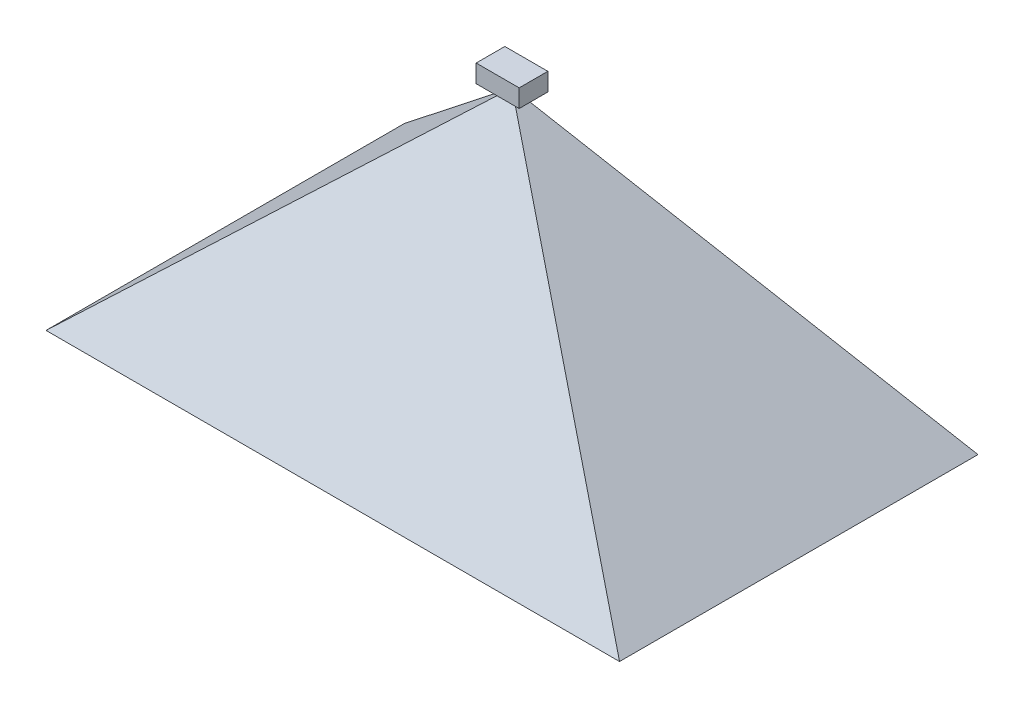
from build123d import *

# Parameters (mm, degrees)
SKETCH3_R         = 2.54
CAMERA_LENS_DEPTH = 2.54
SKETCH4_W         = 15.24
SKETCH4_H         = 10.16
CAMERA_BODY_DEPTH = 6.35


with BuildPart() as part:
    # Sketch2 → FOV section 0
    with BuildSketch(Plane(origin=(0, 90.932, 0), x_dir=(1, 0, 0), z_dir=(0, 1, 0))):
        with BuildLine():
            Line((-2.755394972, -1.722121857), (2.755394972, -1.722121857))
            Line((2.755394972, -1.722121857), (2.755394972, 1.722121857))
            Line((2.755394972, 1.722121857), (-2.755394972, 1.722121857))
            Line((-2.755394972, 1.722121857), (-2.755394972, -1.722121857))
        make_face()
    # Sketch1 → FOV section 1
    with BuildSketch(Plane(origin=(0, 0, 0), x_dir=(1, 0, 0), z_dir=(0, 1, 0))):
        with BuildLine():
            Line((-101.6, -63.5), (101.6, -63.5))
            Line((101.6, -63.5), (101.6, 63.5))
            Line((101.6, 63.5), (-101.6, 63.5))
            Line((-101.6, 63.5), (-101.6, -63.5))
        make_face()
    loft()

    # Sketch3 → camera lens (add)
    with BuildSketch(Plane(origin=(0, 90.932, 0), x_dir=(1, 0, 0), z_dir=(0, 1, 0))):
        with Locations(Location((0, 0, 0), (0, 0, 137.312390012))):
            Circle(SKETCH3_R)
    extrude(amount=CAMERA_LENS_DEPTH)

    # Sketch4 → camera body (add)
    with BuildSketch(Plane(origin=(0, 93.472, 0), x_dir=(1, 0, 0), z_dir=(0, 1, 0))):
        Rectangle(SKETCH4_W, SKETCH4_H)
    extrude(amount=CAMERA_BODY_DEPTH)


solid = part.part
